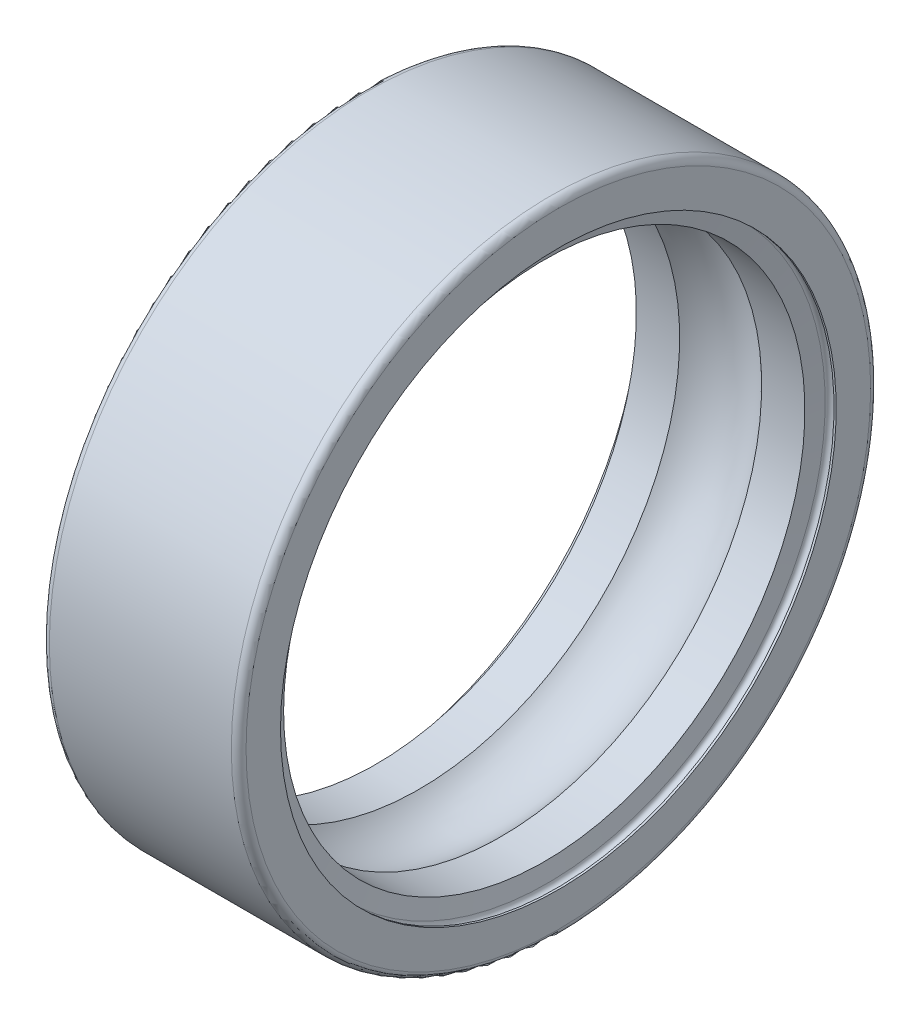
from build123d import *


with BuildPart() as part:
    # Sketch1 → Revolve1 (revolve)
    with BuildSketch(Plane.XY, mode=Mode.PRIVATE) as revolve1_sk:
        with BuildLine():
            Line((0, 11.3), (0.09, 11.3))
            ThreePointArc((0.09, 11.3), (0.27, 11.48), (0.45, 11.3))
            Line((0.45, 11.3), (0.573428886, 10.6))
            Line((0.573428886, 10.6), (2.332918418, 10.6))
            ThreePointArc((2.332918418, 10.6), (4, 11.281), (5.667081582, 10.6))
            Line((5.667081582, 10.6), (7.426571114, 10.6))
            Line((7.426571114, 10.6), (7.55, 11.3))
            ThreePointArc((7.55, 11.3), (7.73, 11.48), (7.91, 11.3))
            Line((7.91, 11.3), (8, 11.3))
            Line((8, 11.3), (8, 12.7))
            ThreePointArc((8, 12.7), (7.912132034, 12.912132034), (7.7, 13))
            Line((7.7, 13), (0.3, 13))
            ThreePointArc((0.3, 13), (0.087867966, 12.912132034), (0, 12.7))
            Line((0, 12.7), (0, 11.3))
        make_face()
    revolve(revolve1_sk.sketch.rotate(Axis((50, 0, 0), (-1, 0, 0)), 270), axis=Axis((50, 0, 0), (-1, 0, 0)))


solid = part.part
